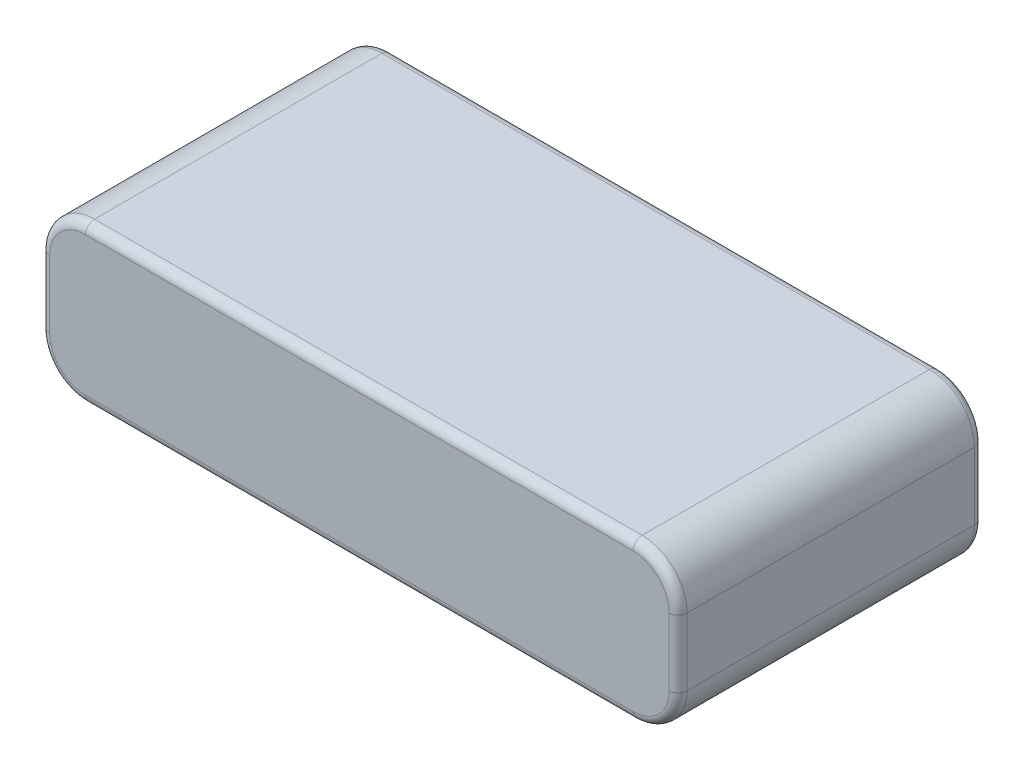
from build123d import *

# Parameters (mm, degrees)
SKETCH_1_W      = 71
SKETCH_1_H      = 34
EXTRUDE_1_DEPTH = 17.5
FILLET_1_R      = 5
FILLET_2_R      = 1


with BuildPart() as part:
    # 草图1 → 凸台-拉伸1 (new body)
    with BuildSketch(Plane(origin=(0, 0, 0), x_dir=(1, 0, 0), z_dir=(0, 1, 0))):
        Rectangle(SKETCH_1_W, SKETCH_1_H)
    extrude(amount=EXTRUDE_1_DEPTH)

    # 圆角1
    fillet_1_edges = [part.edges().sort_by_distance(p)[0] for p in [
        (35.5, 17.5, 0),
        (-35.5, 17.5, 0),
        (35.5, 0, 0),
        (-35.5, 0, 0),
    ]]
    fillet(fillet_1_edges, radius=FILLET_1_R)

    # 圆角2
    fillet_2_edges = [part.edges().sort_by_distance(p)[0] for p in [
        (-35.5, 8.75, 17),
        (-35.5, 8.75, -17),
        (0, 0, 17),
        (35.5, 8.75, 17),
        (0, 17.5, 17),
        (-34.035533906, 16.035533906, 17),
        (34.035533906, 16.035533906, 17),
        (34.035533906, 1.464466094, 17),
        (-34.035533906, 1.464466094, 17),
        (0, 0, -17),
        (0, 17.5, -17),
        (35.5, 8.75, -17),
        (-34.035533906, 16.035533906, -17),
        (34.035533906, 16.035533906, -17),
        (34.035533906, 1.464466094, -17),
        (-34.035533906, 1.464466094, -17),
    ]]
    fillet(fillet_2_edges, radius=FILLET_2_R)


solid = part.part
